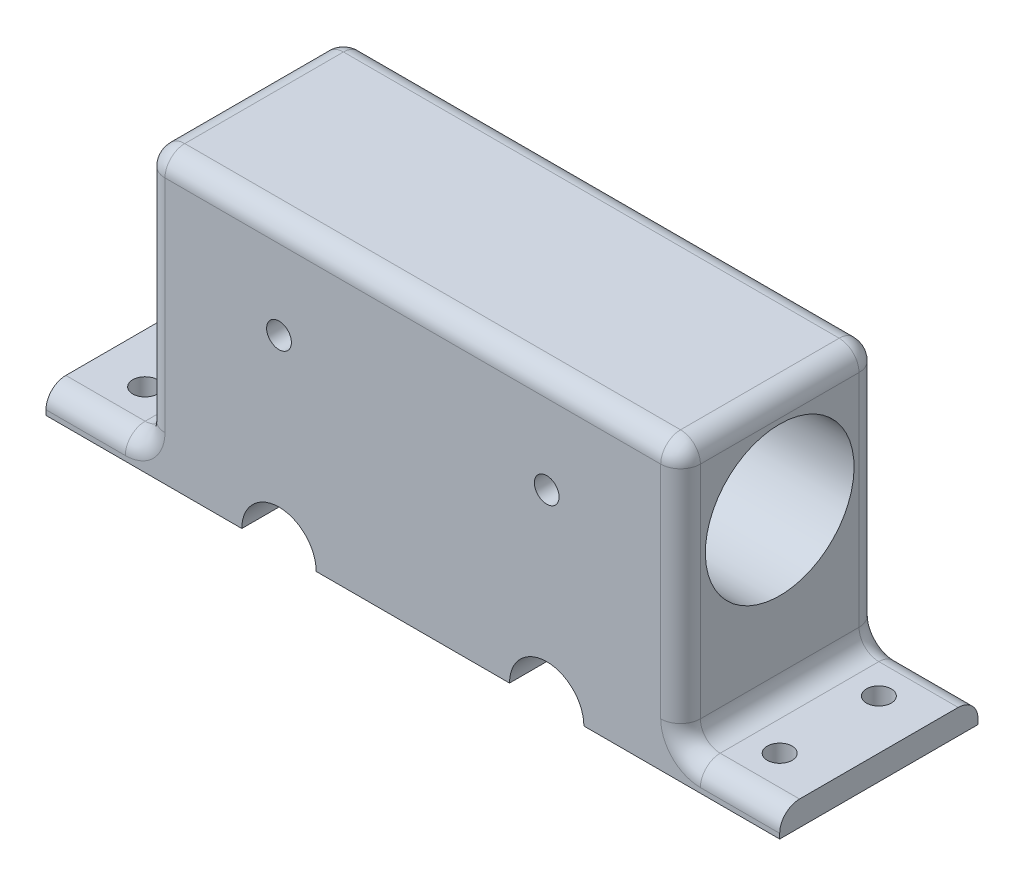
from build123d import *

# Parameters (mm, degrees)
BOSS_EXTRUDE1_DEPTH = 25.4
SKETCH2_R           = 1.5875
CUT_EXTRUDE1_DEPTH  = 63.965141199
SKETCH3_R           = 9.525
CUT_EXTRUDE2_DEPTH  = 93.653985647
SKETCH4_R           = 1.5875
CUT_EXTRUDE3_DEPTH  = 65.702262374
FILLET1_R           = 2.54


with BuildPart() as part:
    # Sketch1 → Boss-Extrude1 (new body)
    with BuildSketch(Plane.XY):
        with BuildLine():
            Line((-12.3825, 0), (12.3825, 0))
            ThreePointArc((12.3825, 0), (17.145, 4.7625), (21.9075, 0))
            Line((21.9075, 0), (46.99, 0))
            Line((46.99, 0), (46.99, 3.175))
            Line((46.99, 3.175), (36.83, 3.175))
            ThreePointArc((36.83, 3.175), (35.033948776, 3.918948776), (34.29, 5.715))
            Line((34.29, 5.715), (34.29, 36.5125))
            Line((34.29, 36.5125), (-34.29, 36.5125))
            Line((-34.29, 36.5125), (-34.29, 5.715))
            ThreePointArc((-34.29, 5.715), (-35.033948776, 3.918948776), (-36.83, 3.175))
            Line((-36.83, 3.175), (-46.99, 3.175))
            Line((-46.99, 3.175), (-46.99, 0))
            Line((-46.99, 0), (-21.9075, 0))
            ThreePointArc((-21.9075, 0), (-17.145, 4.7625), (-12.3825, 0))
        make_face()
    extrude(amount=BOSS_EXTRUDE1_DEPTH)

    # Sketch2 → Cut-Extrude1 (cut, through all)
    with BuildSketch(Plane(origin=(0, 3.175, 0), x_dir=(1, 0, 0), z_dir=(0, 1, 0))):
        with Locations(Location((40.64, -6.35, 0), (0, 0, 180))):
            Circle(SKETCH2_R)
        with Locations((40.64, -19.05)):
            Circle(SKETCH2_R)
        with Locations((-40.64, -6.35)):
            Circle(SKETCH2_R)
        with Locations(Location((-40.64, -19.05, 0), (0, 0, 180))):
            Circle(SKETCH2_R)
    extrude(amount=-CUT_EXTRUDE1_DEPTH, mode=Mode.SUBTRACT)

    # Sketch3 → Cut-Extrude2 (cut, through all)
    with BuildSketch(Plane(origin=(34.29, 0, 0), x_dir=(0, 0, -1), z_dir=(1, 0, 0))):
        with Locations(Location((-12.7, 23.8125, 0), (0, 0, 90))):
            Circle(SKETCH3_R)
    extrude(amount=-CUT_EXTRUDE2_DEPTH, mode=Mode.SUBTRACT)

    # Sketch4 → Cut-Extrude3 (cut, through all)
    with BuildSketch(Plane.XY.offset(25.4)):
        with Locations((17.145, 23.8125)):
            Circle(SKETCH4_R)
        with Locations((-17.145, 23.8125)):
            Circle(SKETCH4_R)
    extrude(amount=-CUT_EXTRUDE3_DEPTH, mode=Mode.SUBTRACT)

    # Fillet1
    fillet1_edges = [part.edges().sort_by_distance(p)[0] for p in [
        (-41.91, 3.175, 0),
        (-35.033948776, 3.918948776, 0),
        (-34.29, 21.11375, 0),
        (0, 36.5125, 0),
        (41.91, 3.175, 25.4),
        (34.29, 21.11375, 0),
        (35.033948776, 3.918948776, 0),
        (41.91, 3.175, 0),
        (35.033948776, 3.918948776, 25.4),
        (-34.29, 36.5125, 12.7),
        (34.29, 36.5125, 12.7),
        (34.29, 21.11375, 25.4),
        (0, 36.5125, 25.4),
        (-34.29, 21.11375, 25.4),
        (-35.033948776, 3.918948776, 25.4),
        (-41.91, 3.175, 25.4),
    ]]
    fillet(fillet1_edges, radius=FILLET1_R)


solid = part.part
